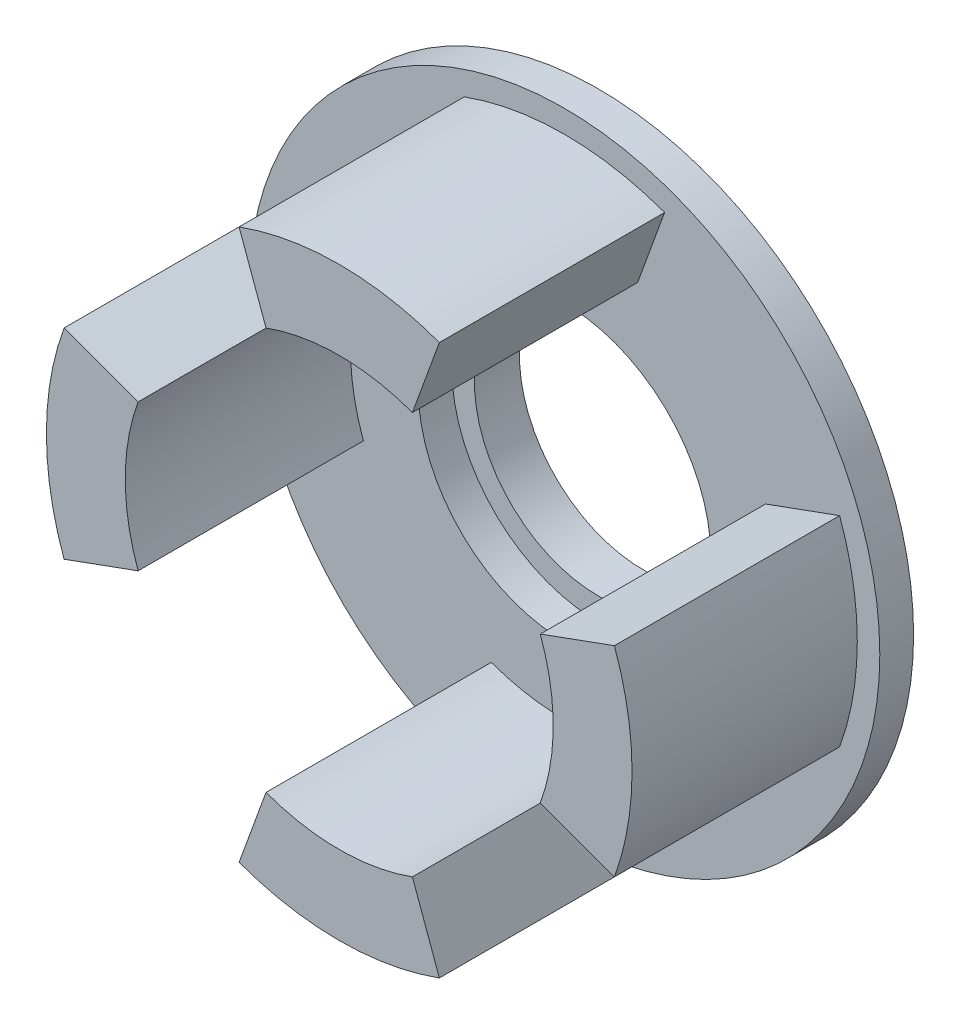
from build123d import *

# Parameters (mm, degrees)
SKETCH_1_R      = 16
SKETCH_1_R_2    = 11
EXTRUDE_1_DEPTH = 4
SKETCH_2_R      = 28
SKETCH_2_R_2    = 13
EXTRUDE_2_DEPTH = 3
EXTRUDE_3_DEPTH = 20


with BuildPart() as part:
    # 草图1 → 凸台-拉伸1 (new body)
    with BuildSketch(Plane.XY):
        Circle(SKETCH_1_R)
        Circle(SKETCH_1_R_2, mode=Mode.SUBTRACT)
    extrude(amount=EXTRUDE_1_DEPTH)

    # 草图2 → 凸台-拉伸2 (add)
    with BuildSketch(Plane.XY.offset(4)):
        Circle(SKETCH_2_R)
        Circle(SKETCH_2_R_2, mode=Mode.SUBTRACT)
    extrude(amount=EXTRUDE_2_DEPTH)

    # 草图3 → 凸台-拉伸3 (add)
    with BuildSketch(Plane.XY.offset(7)):
        with BuildLine():
            Line((-8.892523726, 24.43200814), (-6.498382723, 17.854159795))
            ThreePointArc((-6.498382723, 17.854159795), (0, 19), (6.498382723, 17.854159795))
            Line((6.498382723, 17.854159795), (8.892523726, 24.43200814))
            ThreePointArc((8.892523726, 24.43200814), (0, 26), (-8.892523726, 24.43200814))
        make_face()
        with BuildLine():
            Line((24.43200814, 8.892523726), (17.854159795, 6.498382723))
            ThreePointArc((17.854159795, 6.498382723), (19, 0), (17.854159795, -6.498382723))
            Line((17.854159795, -6.498382723), (24.43200814, -8.892523726))
            ThreePointArc((24.43200814, -8.892523726), (26, 0), (24.43200814, 8.892523726))
        make_face()
        with BuildLine():
            Line((8.892523726, -24.43200814), (6.498382723, -17.854159795))
            ThreePointArc((6.498382723, -17.854159795), (0, -19), (-6.498382723, -17.854159795))
            Line((-6.498382723, -17.854159795), (-8.892523726, -24.43200814))
            ThreePointArc((-8.892523726, -24.43200814), (0, -26), (8.892523726, -24.43200814))
        make_face()
        with BuildLine():
            Line((-24.43200814, -8.892523726), (-17.854159795, -6.498382723))
            ThreePointArc((-17.854159795, -6.498382723), (-19, 0), (-17.854159795, 6.498382723))
            Line((-17.854159795, 6.498382723), (-24.43200814, 8.892523726))
            ThreePointArc((-24.43200814, 8.892523726), (-26, 0), (-24.43200814, -8.892523726))
        make_face()
    extrude(amount=EXTRUDE_3_DEPTH)


solid = part.part
